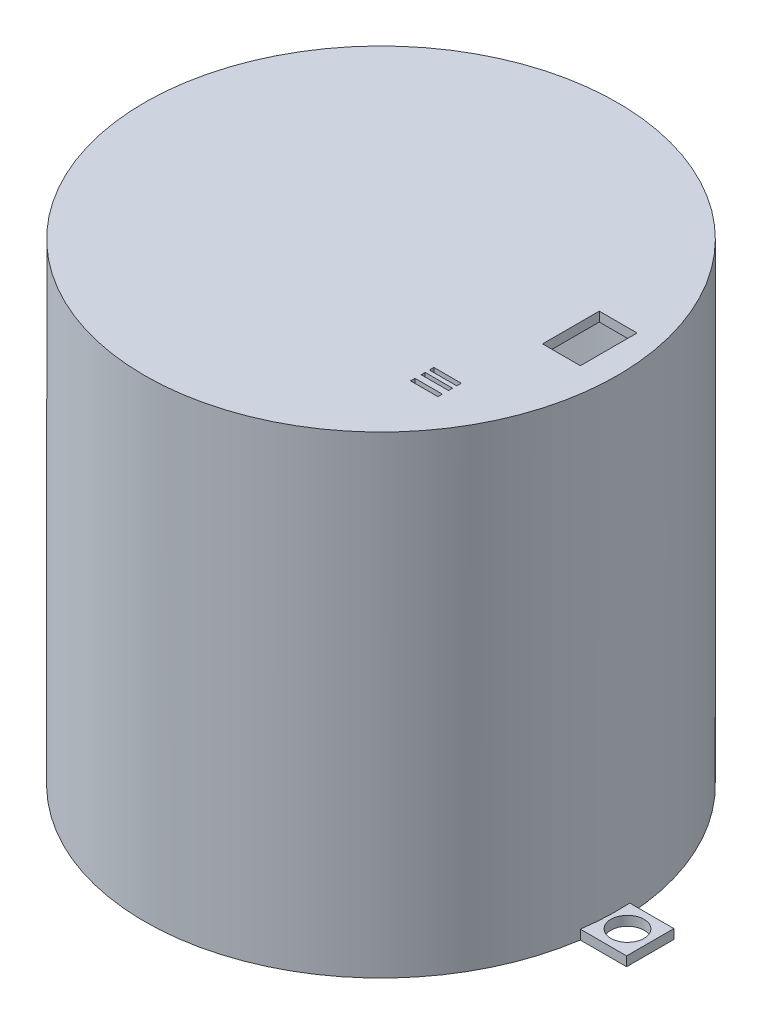
from build123d import *

# Parameters (mm, degrees)
SKETCH2_R            = 50
BOSS_EXTRUDE1_DEPTH  = 100
SKETCH3_W            = 60
SKETCH3_H            = 80
CUT_EXTRUDE1_DEPTH   = 60
SKETCH4_W            = 60
SKETCH4_H            = 79.669831605
BOSS_EXTRUDE3_DEPTH  = 40
SKETCH5_R            = 38
CUT_EXTRUDE2_DEPTH   = 90
SKETCH8_W            = 60
SKETCH8_H            = 79.669831605
CUT_EXTRUDE7_DEPTH   = 50
SKETCH10_R           = 48.665518172
CUT_EXTRUDE9_DEPTH   = 100
SKETCH11_W           = 1.681170961
SKETCH11_H           = 60
BOSS_EXTRUDE5_DEPTH  = 80
SKETCH13_W           = 1.681170961
SKETCH13_H           = 60
BOSS_EXTRUDE7_DEPTH  = 10
BOSS_EXTRUDE8_DEPTH  = 10
CUT_EXTRUDE10_START  = -5
CUT_EXTRUDE10_DEPTH  = 5
SKETCH19_R           = 8.164764715
BOSS_EXTRUDE10_DEPTH = 5
SKETCH20_R           = 7.047060341
CUT_EXTRUDE11_DEPTH  = 9
SKETCH21_W           = 5.787931414
SKETCH21_H           = 0.934183286
SKETCH21_H_2         = 0.954014791
SKETCH21_H_3         = 0.849697664
CUT_EXTRUDE12_DEPTH  = 9
SKETCH23_R           = 2.195287673
SKETCH23_W           = 25
SKETCH23_H           = 74
CUT_EXTRUDE13_DEPTH  = 9
SKETCH24_W           = 15
SKETCH24_H           = 5
BOSS_EXTRUDE11_DEPTH = 98
SKETCH25_W           = 18.827507882
SKETCH25_H           = 73.375554396
CUT_EXTRUDE14_DEPTH  = 98
SKETCH26_W           = 18.827507882
SKETCH26_H           = 73.375554396
BOSS_EXTRUDE12_DEPTH = 1
SKETCH27_W           = 10.029903479
SKETCH27_H           = 10
BOSS_EXTRUDE13_DEPTH = 2
SKETCH28_R           = 3.5
CUT_EXTRUDE15_DEPTH  = 2
SKETCH29_W           = 58.538941248
SKETCH29_H           = 14.680012791
CUT_EXTRUDE16_DEPTH  = 98
SKETCH30_W           = 20.214113165
SKETCH30_H           = 34.255978035
CUT_EXTRUDE17_DEPTH  = 98
SKETCH33_W           = 8
SKETCH33_H           = 12
CUT_EXTRUDE19_DEPTH  = 98
SKETCH34_W           = 16.356457981
SKETCH34_H           = 26.077749045
CUT_EXTRUDE20_DEPTH  = 98
SKETCH35_W           = 19.445222932
SKETCH35_H           = 19.770916388
CUT_EXTRUDE21_DEPTH  = 10
SKETCH36_W           = 19.989215452
SKETCH36_H           = 72.827965385
CUT_EXTRUDE24_DEPTH  = 10
SKETCH37_W           = 31.787676572
SKETCH37_H           = 10.342401947
CUT_EXTRUDE26_DEPTH  = 10
SKETCH38_W           = 20.901341983
SKETCH38_H           = 4.203034319
SKETCH38_H_2         = 3.820046546
SKETCH38_W_2         = 30.533824488
SKETCH38_H_3         = 14.057901902
CUT_EXTRUDE32_DEPTH  = 2
SKETCH39_W           = 30.533824488
SKETCH39_H           = 14.057901902
CUT_EXTRUDE33_DEPTH  = 1
SKETCH40_W           = 20.553607572
SKETCH40_H           = 73.375554396
BOSS_EXTRUDE14_DEPTH = 1
SKETCH41_W           = 32.621281634
SKETCH41_H           = 15.74299434
CUT_EXTRUDE34_DEPTH  = 3
SKETCH42_W           = 14.144755604
SKETCH42_H           = 8.69656923
CUT_EXTRUDE35_DEPTH  = 3
SKETCH43_W           = 59.644827438
SKETCH43_H           = 2.247870114
CUT_EXTRUDE36_DEPTH  = 3
SKETCH44_W           = 17.667291541
SKETCH44_H           = 3.320818604
SKETCH44_W_2         = 14.753104975
SKETCH44_H_2         = 11.677562162
CUT_EXTRUDE38_DEPTH  = 3
SKETCH46_W           = 17.667291541
SKETCH46_H           = 3.320818604
CUT_EXTRUDE40_DEPTH  = 1
SKETCH47_W           = 1.701021163
SKETCH47_H           = 8.211244537
CUT_EXTRUDE41_DEPTH  = 3
SKETCH48_W           = 15.966270378
SKETCH48_H           = 2.478389594
CUT_EXTRUDE42_DEPTH  = 3
SKETCH49_W           = 10.473630753
SKETCH49_H           = 60
CUT_EXTRUDE43_DEPTH  = 3
CUT_EXTRUDE44_DEPTH  = 3
SKETCH51_W           = 3.315159192
SKETCH51_H           = 22.138520704
CUT_EXTRUDE45_DEPTH  = 3
CUT_EXTRUDE52_START  = -3
CUT_EXTRUDE52_DEPTH  = 3
CUT_EXTRUDE57_START  = -3
CUT_EXTRUDE57_DEPTH  = 3
CUT_EXTRUDE58_START  = -3
CUT_EXTRUDE58_DEPTH  = 3
CUT_EXTRUDE59_START  = -3
CUT_EXTRUDE59_DEPTH  = 3
CUT_EXTRUDE60_START  = -3
CUT_EXTRUDE60_DEPTH  = 3
SKETCH59_W           = 11.723658734
SKETCH59_H           = 19.471980535
CUT_EXTRUDE63_DEPTH  = 1
SKETCH60_W           = 11.417157191
SKETCH60_H           = 17.445400415
CUT_EXTRUDE65_DEPTH  = 3
CUT_EXTRUDE66_START  = -3
CUT_EXTRUDE66_DEPTH  = 3


with BuildPart() as part:
    # Sketch2 → Boss-Extrude1 (new body)
    with BuildSketch(Plane(origin=(0, 0, 0), x_dir=(1, 0, 0), z_dir=(0, 1, 0))):
        with Locations(Location((0, 0, 0), (0, 0, 270))):
            Circle(SKETCH2_R)
    extrude(amount=BOSS_EXTRUDE1_DEPTH)

    # Sketch3 → Cut-Extrude1 (cut)
    with BuildSketch(Plane(origin=(0, 0, 0), x_dir=(0, 0, -1), z_dir=(1, 0, 0))):
        with Locations((0, 50)):
            Rectangle(SKETCH3_W, SKETCH3_H)
    extrude(amount=-CUT_EXTRUDE1_DEPTH, mode=Mode.SUBTRACT)

    # Sketch4 → Boss-Extrude3 (add)
    with BuildSketch(Plane.ZY):
        with Locations((0, 49.834915802)):
            Rectangle(SKETCH4_W, SKETCH4_H)
    extrude(amount=BOSS_EXTRUDE3_DEPTH)

    # Sketch5 → Cut-Extrude2 (cut)
    with BuildSketch(Plane(origin=(0, 0, 0), x_dir=(1, 0, 0), z_dir=(0, 1, 0))):
        with Locations(Location((0, 0, 0), (0, 0, 127.863646362))):
            Circle(SKETCH5_R)
    extrude(amount=CUT_EXTRUDE2_DEPTH, mode=Mode.SUBTRACT)

    # Sketch8 → Cut-Extrude7 (cut)
    with BuildSketch(Plane.ZY.offset(40)):
        with Locations((0, 49.834915802)):
            Rectangle(SKETCH8_W, SKETCH8_H)
    extrude(amount=-CUT_EXTRUDE7_DEPTH, mode=Mode.SUBTRACT)

    # Sketch10 → Cut-Extrude9 (cut)
    with BuildSketch(Plane(origin=(0, 90, 0), x_dir=(-1, 0, 0), z_dir=(0, -1, 0))):
        with Locations(Location((0, 0, 0), (0, 0, 270))):
            Circle(SKETCH10_R)
    extrude(amount=CUT_EXTRUDE9_DEPTH, mode=Mode.SUBTRACT)

    # Sketch11 → Boss-Extrude5 (add)
    with BuildSketch(Plane.XZ.offset(-90)):
        with Locations((-39.15941452, 0)):
            Rectangle(SKETCH11_W, SKETCH11_H)
    extrude(amount=BOSS_EXTRUDE5_DEPTH)

    # Sketch13 → Boss-Extrude7 (add)
    with BuildSketch(Plane.XZ.offset(-10)):
        with Locations((-39.15941452, 0)):
            Rectangle(SKETCH13_W, SKETCH13_H)
    extrude(amount=BOSS_EXTRUDE7_DEPTH)

    # Sketch16 → Boss-Extrude8 (add)
    with BuildSketch(Plane.XZ):
        with BuildLine():
            Line((-39.280045299, -29.075196623), (-39.280045299, 29.238392007))
            ThreePointArc((-39.280045299, 29.238392007), (-49.347436006, 0.081597692), (-39.280045299, -29.075196623))
        make_face()
    extrude(amount=-BOSS_EXTRUDE8_DEPTH)

    # Sketch17 → Cut-Extrude10 (cut)
    with BuildSketch(Plane.XZ.offset(-90).offset(CUT_EXTRUDE10_START)):
        with BuildLine():
            Line((-38.318829039, 30), (-38.318829039, -30))
            ThreePointArc((-38.318829039, -30), (48.665518172, 0), (-38.318829039, 30))
        make_face()
    extrude(amount=CUT_EXTRUDE10_DEPTH, mode=Mode.SUBTRACT)

    # Sketch19 → Boss-Extrude10 (add)
    with BuildSketch(Plane(origin=(0, 95, 0), x_dir=(-1, 0, 0), z_dir=(0, -1, 0))):
        with Locations(Location((-31.46311806, -20.549866857, 0), (0, 0, 90))):
            Circle(SKETCH19_R)
    extrude(amount=BOSS_EXTRUDE10_DEPTH)

    # Sketch20 → Cut-Extrude11 (cut)
    with BuildSketch(Plane(origin=(0, 90, 0), x_dir=(-1, 0, 0), z_dir=(0, -1, 0))):
        with Locations(Location((-31.537874796, -20.642045838, 0), (0, 0, 90))):
            Circle(SKETCH20_R)
    extrude(amount=-CUT_EXTRUDE11_DEPTH, mode=Mode.SUBTRACT)

    # Sketch21 → Cut-Extrude12 (cut)
    with BuildSketch(Plane.XZ.offset(-99)):
        with Locations((31.992398498, 22.385566745)):
            Rectangle(SKETCH21_W, SKETCH21_H)
        with Locations((31.992398498, 18.399985322)):
            Rectangle(SKETCH21_W, SKETCH21_H_2)
        with Locations((31.992398498, 20.17878045)):
            Rectangle(SKETCH21_W, SKETCH21_H_3)
    extrude(amount=-CUT_EXTRUDE12_DEPTH, mode=Mode.SUBTRACT)

    # Sketch23 → Cut-Extrude13 (cut)
    with BuildSketch(Plane.ZY.offset(40)):
        with Locations((12.438591757, 73.104072914)):
            Circle(SKETCH23_R)
        with Locations((12.438591757, 51.018979374)):
            Circle(SKETCH23_R)
        with Locations((12.438591757, 27.461546264)):
            Circle(SKETCH23_R)
        with Locations((-13.476086098, 50.407395829)):
            Rectangle(SKETCH23_W, SKETCH23_H)
    extrude(amount=-CUT_EXTRUDE13_DEPTH, mode=Mode.SUBTRACT)

    # Sketch24 → Boss-Extrude11 (add)
    with BuildSketch(Plane(origin=(0, 100, 0), x_dir=(1, 0, 0), z_dir=(0, 1, 0))):
        with Locations((-0.85785595, -17.5)):
            Rectangle(SKETCH24_W, SKETCH24_H)
        with Locations((-0.572910756, 17.5)):
            Rectangle(SKETCH24_W, SKETCH24_H)
    extrude(amount=-BOSS_EXTRUDE11_DEPTH)

    # Sketch25 → Cut-Extrude14 (cut)
    with BuildSketch(Plane(origin=(0, 100, 0), x_dir=(1, 0, 0), z_dir=(0, 1, 0))):
        with Locations((-19.961314115, 0.829554283)):
            Rectangle(SKETCH25_W, SKETCH25_H)
    extrude(amount=-CUT_EXTRUDE14_DEPTH, mode=Mode.SUBTRACT)

    # Sketch26 → Boss-Extrude12 (add)
    with BuildSketch(Plane(origin=(0, 100, 0), x_dir=(1, 0, 0), z_dir=(0, 1, 0))):
        with Locations((-19.961314115, 0.829554283)):
            Rectangle(SKETCH26_W, SKETCH26_H)
    extrude(amount=-BOSS_EXTRUDE12_DEPTH)

    # Sketch27 → Boss-Extrude13 (add)
    with BuildSketch(Plane.XZ):
        with Locations((54.238631889, 2.31459311)):
            Rectangle(SKETCH27_W, SKETCH27_H)
        with Locations((-54.238631889, 0.679426194)):
            Rectangle(SKETCH27_W, SKETCH27_H)
    extrude(amount=-BOSS_EXTRUDE13_DEPTH)

    # Sketch28 → Cut-Extrude15 (cut)
    with BuildSketch(Plane.XZ):
        with Locations(Location((-54.053583629, 0, 0), (0, 0, 270))):
            Circle(SKETCH28_R)
        with Locations(Location((54.396100908, 2.272206882, 0), (0, 0, 270))):
            Circle(SKETCH28_R)
    extrude(amount=-CUT_EXTRUDE15_DEPTH, mode=Mode.SUBTRACT)

    # Sketch29 → Cut-Extrude16 (cut)
    with BuildSketch(Plane.XZ):
        with Locations((-0.105597432, -30.177325086)):
            Rectangle(SKETCH29_W, SKETCH29_H)
    extrude(amount=-CUT_EXTRUDE16_DEPTH, mode=Mode.SUBTRACT)

    # Sketch30 → Cut-Extrude17 (cut)
    with BuildSketch(Plane.XZ):
        with Locations((19.05681661, -5.709329673)):
            Rectangle(SKETCH30_W, SKETCH30_H)
    extrude(amount=-CUT_EXTRUDE17_DEPTH, mode=Mode.SUBTRACT)

    # Sketch33 → Cut-Extrude19 (cut)
    with BuildSketch(Plane.XZ.offset(-95)):
        with Locations((40.285881514, -3.875597271)):
            Rectangle(SKETCH33_W, SKETCH33_H)
    extrude(amount=-CUT_EXTRUDE19_DEPTH, mode=Mode.SUBTRACT)

    # Sketch34 → Cut-Extrude20 (cut)
    with BuildSketch(Plane.XZ):
        with Locations((37.342102182, -1.620215178)):
            Rectangle(SKETCH34_W, SKETCH34_H)
    extrude(amount=-CUT_EXTRUDE20_DEPTH, mode=Mode.SUBTRACT)

    # Sketch35 → Cut-Extrude21 (cut)
    with BuildSketch(Plane.XZ.offset(-98)):
        with Locations((-0.772851439, -1.419797355)):
            Rectangle(SKETCH35_W, SKETCH35_H)
    extrude(amount=CUT_EXTRUDE21_DEPTH, mode=Mode.SUBTRACT)

    # Sketch36 → Cut-Extrude24 (cut)
    with BuildSketch(Plane.XZ.offset(-98)):
        with Locations((-18.71213924, -1.103348788)):
            Rectangle(SKETCH36_W, SKETCH36_H)
    extrude(amount=CUT_EXTRUDE24_DEPTH, mode=Mode.SUBTRACT)

    # Sketch37 → Cut-Extrude26 (cut)
    with BuildSketch(Plane.XZ.offset(-98)):
        with Locations((6.007718778, 9.277742922)):
            Rectangle(SKETCH37_W, SKETCH37_H)
    extrude(amount=CUT_EXTRUDE26_DEPTH, mode=Mode.SUBTRACT)

    # Sketch38 → Cut-Extrude32 (cut)
    with BuildSketch(Plane(origin=(0, 95, 0), x_dir=(-1, 0, 0), z_dir=(0, -1, 0))):
        with Locations((-0.612367359, 12.524556994)):
            Rectangle(SKETCH38_W, SKETCH38_H)
        with Locations((-0.612367359, 23.030255384)):
            Rectangle(SKETCH38_W, SKETCH38_H_2)
        with Locations((-6.54938073, -28.281682953)):
            Rectangle(SKETCH38_W_2, SKETCH38_H_3)
    extrude(amount=-CUT_EXTRUDE32_DEPTH, mode=Mode.SUBTRACT)

    # Sketch39 → Cut-Extrude33 (cut)
    with BuildSketch(Plane.XZ.offset(-97)):
        with Locations((6.54938073, 28.281682953)):
            Rectangle(SKETCH39_W, SKETCH39_H)
    extrude(amount=-CUT_EXTRUDE33_DEPTH, mode=Mode.SUBTRACT)

    # Sketch40 → Boss-Extrude14 (add)
    with BuildSketch(Plane.XZ.offset(-99)):
        with Locations((-19.09826427, -0.829554283)):
            Rectangle(SKETCH40_W, SKETCH40_H)
    extrude(amount=BOSS_EXTRUDE14_DEPTH)

    # Sketch41 → Cut-Extrude34 (cut)
    with BuildSketch(Plane.XZ.offset(-95)):
        with Locations((5.763080643, 27.986725745)):
            Rectangle(SKETCH41_W, SKETCH41_H)
    extrude(amount=-CUT_EXTRUDE34_DEPTH, mode=Mode.SUBTRACT)

    # Sketch42 → Cut-Extrude35 (cut)
    with BuildSketch(Plane.XZ.offset(-95)):
        with Locations((14.829179262, 15.76694396)):
            Rectangle(SKETCH42_W, SKETCH42_H)
    extrude(amount=-CUT_EXTRUDE35_DEPTH, mode=Mode.SUBTRACT)

    # Sketch43 → Cut-Extrude36 (cut)
    with BuildSketch(Plane.XZ.offset(-95)):
        with Locations((0.447345663, 36.982157972)):
            Rectangle(SKETCH43_W, SKETCH43_H)
    extrude(amount=-CUT_EXTRUDE36_DEPTH, mode=Mode.SUBTRACT)

    # Sketch44 → Cut-Extrude38 (cut)
    with BuildSketch(Plane.XZ.offset(-97)):
        with Locations((0.116114256, -12.965664851)):
            Rectangle(SKETCH44_W, SKETCH44_H)
        with Locations((31.548416401, -18.552621957)):
            Rectangle(SKETCH44_W_2, SKETCH44_H_2)
    extrude(amount=CUT_EXTRUDE38_DEPTH, mode=Mode.SUBTRACT)

    # Sketch46 → Cut-Extrude40 (cut)
    with BuildSketch(Plane.XZ.offset(-97)):
        with Locations((0.116114256, -12.965664851)):
            Rectangle(SKETCH46_W, SKETCH46_H)
    extrude(amount=-CUT_EXTRUDE40_DEPTH, mode=Mode.SUBTRACT)

    # Sketch47 → Cut-Extrude41 (cut)
    with BuildSketch(Plane.XZ.offset(-95)):
        with Locations((8.099249445, -18.731696422)):
            Rectangle(SKETCH47_W, SKETCH47_H)
    extrude(amount=-CUT_EXTRUDE41_DEPTH, mode=Mode.SUBTRACT)

    # Sketch48 → Cut-Extrude42 (cut)
    with BuildSketch(Plane.XZ.offset(-95)):
        with Locations((-0.734396325, -21.598123893)):
            Rectangle(SKETCH48_W, SKETCH48_H)
    extrude(amount=-CUT_EXTRUDE42_DEPTH, mode=Mode.SUBTRACT)

    # Sketch49 → Cut-Extrude43 (cut)
    with BuildSketch(Plane.XZ.offset(-95)):
        with Locations((-33.082013663, 0)):
            Rectangle(SKETCH49_W, SKETCH49_H)
    extrude(amount=-CUT_EXTRUDE43_DEPTH, mode=Mode.SUBTRACT)

    # Sketch50 → Cut-Extrude44 (cut)
    with BuildSketch(Plane.XZ.offset(-95)):
        Polygon((22.07372146, 20.115228575), (22.07372146, 29.87376114), (21.033576275, 29.87376114), (21.033576275, 10.941534653), (22.07372146, 10.941534653), (22.07372146, 11.418659345), (21.901557064, 11.418659345), (21.901557064, 20.115228575), align=None)
        Polygon((30.269759382, 35.858222915), (22.07372146, 35.858222915), (22.07372146, 29.87376114), (31.551479878, 29.87376114), (31.551479878, 35.858222915), align=None)
    extrude(amount=-CUT_EXTRUDE44_DEPTH, mode=Mode.SUBTRACT)

    # Sketch51 → Cut-Extrude45 (cut)
    with BuildSketch(Plane.XZ.offset(-95)):
        with Locations((20.889886083, 20.153945891)):
            Rectangle(SKETCH51_W, SKETCH51_H)
    extrude(amount=-CUT_EXTRUDE45_DEPTH, mode=Mode.SUBTRACT)

    # Sketch53 → Cut-Extrude52 (cut)
    with BuildSketch(Plane.XZ.offset(-95).offset(CUT_EXTRUDE52_START)):
        with BuildLine():
            Line((-38.318829039, -30), (-29.375068056, -30))
            Line((-29.375068056, -30), (-29.375068056, -37.517331481))
            Line((-29.375068056, -37.517331481), (-29.684968226, -38.563393528))
            ThreePointArc((-29.684968226, -38.563393528), (-34.270425118, -34.552432927), (-38.318829039, -30))
        make_face()
    extrude(amount=CUT_EXTRUDE52_DEPTH, mode=Mode.SUBTRACT)

    # Sketch55 → Cut-Extrude57 (cut)
    with BuildSketch(Plane(origin=(0, 95, 0), x_dir=(-1, 0, 0), z_dir=(0, -1, 0)).offset(CUT_EXTRUDE57_START)):
        with BuildLine():
            Line((38.318829039, -30), (29.375068056, -30))
            Line((29.375068056, -30), (29.375068056, -38.106093029))
            Line((29.375068056, -38.106093029), (-30.269759382, -38.106093029))
            ThreePointArc((-30.269759382, -38.106093029), (5.711748124, -48.329169166), (38.318829039, -30))
        make_face()
    extrude(amount=CUT_EXTRUDE57_DEPTH, mode=Mode.SUBTRACT)

    # Sketch56 → Cut-Extrude58 (cut)
    with BuildSketch(Plane(origin=(0, 95, 0), x_dir=(-1, 0, 0), z_dir=(0, -1, 0)).offset(CUT_EXTRUDE58_START)):
        with BuildLine():
            Line((-38.636727711, -29.589456411), (-31.551479878, -29.87376114))
            Line((-31.551479878, -29.87376114), (-31.551479878, -35.858222915))
            Line((-31.551479878, -35.858222915), (-30.269759382, -35.858222915))
            Line((-30.269759382, -35.858222915), (-30.269759382, -38.106093029))
            ThreePointArc((-30.269759382, -38.106093029), (-34.715403867, -34.105327931), (-38.636727711, -29.589456411))
        make_face()
    extrude(amount=CUT_EXTRUDE58_DEPTH, mode=Mode.SUBTRACT)

    # Sketch57 → Cut-Extrude59 (cut)
    with BuildSketch(Plane(origin=(0, 95, 0), x_dir=(-1, 0, 0), z_dir=(0, -1, 0)).offset(CUT_EXTRUDE59_START)):
        with BuildLine():
            Line((-46.333675493, 14.8836546), (-45.520331173, 14.6590897))
            Line((-45.520331173, 14.6590897), (-45.520331173, -11.418659345))
            Line((-45.520331173, -11.418659345), (-47.287832143, -11.497547136))
            ThreePointArc((-47.287832143, -11.497547136), (-48.633719005, 1.75898683), (-46.333675493, 14.8836546))
        make_face()
    extrude(amount=CUT_EXTRUDE59_DEPTH, mode=Mode.SUBTRACT)

    # Sketch58 → Cut-Extrude60 (cut)
    with BuildSketch(Plane(origin=(0, 95, 0), x_dir=(-1, 0, 0), z_dir=(0, -1, 0)).offset(CUT_EXTRUDE60_START)):
        with BuildLine():
            Line((-38.944623515, 29.183025172), (-38.924968888, 14.6590897))
            Line((-38.924968888, 14.6590897), (-45.520331173, 14.6590897))
            Line((-45.520331173, 14.6590897), (-46.333675493, 14.8836546))
            ThreePointArc((-46.333675493, 14.8836546), (-43.23441997, 22.340939748), (-38.944623515, 29.183025172))
        make_face()
    extrude(amount=CUT_EXTRUDE60_DEPTH, mode=Mode.SUBTRACT)

    # Sketch59 → Cut-Extrude63 (cut)
    with BuildSketch(Plane.XZ.offset(-97)):
        with Locations((34.249956279, -16.696142801)):
            Rectangle(SKETCH59_W, SKETCH59_H)
    extrude(amount=-CUT_EXTRUDE63_DEPTH, mode=Mode.SUBTRACT)

    # Sketch60 → Cut-Extrude65 (cut)
    with BuildSketch(Plane.XZ.offset(-95)):
        with Locations((33.23604492, -20.460324964)):
            Rectangle(SKETCH60_W, SKETCH60_H)
    extrude(amount=-CUT_EXTRUDE65_DEPTH, mode=Mode.SUBTRACT)

    # Sketch61 → Cut-Extrude66 (cut)
    with BuildSketch(Plane(origin=(0, 95, 0), x_dir=(-1, 0, 0), z_dir=(0, -1, 0)).offset(CUT_EXTRUDE66_START)):
        with BuildLine():
            Line((29.684968226, 38.563393528), (29.390578265, 37.569685893))
            Line((29.390578265, 37.569685893), (-29.163873192, 37.517331481))
            Line((-29.163873192, 37.517331481), (-29.163873192, 29.183025172))
            Line((-29.163873192, 29.183025172), (-38.944623515, 29.183025172))
            ThreePointArc((-38.944623515, 29.183025172), (-6.590381752, 48.21721194), (29.684968226, 38.563393528))
        make_face()
    extrude(amount=CUT_EXTRUDE66_DEPTH, mode=Mode.SUBTRACT)


solid = part.part
